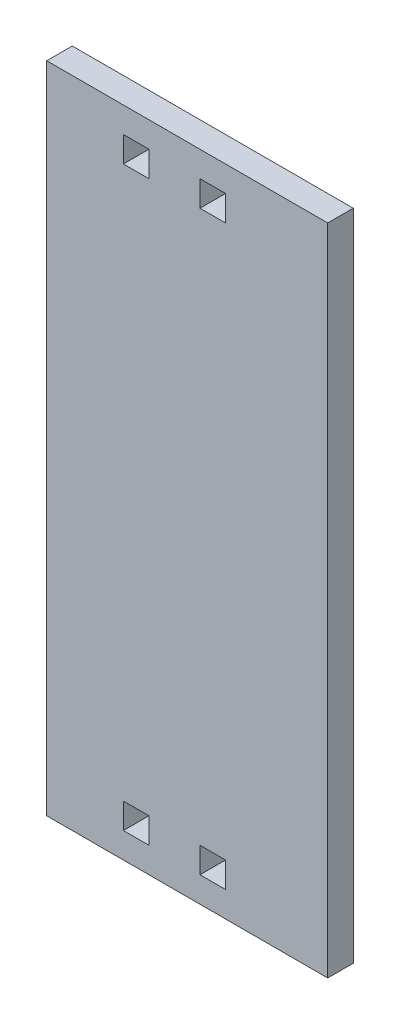
from build123d import *

# Parameters (mm, degrees)
ESQUISSE1_W        = 5
ESQUISSE1_H        = 5
BOSS_EXTRU_1_DEPTH = 5


with BuildPart() as part:
    # Esquisse1 → Boss.-Extru.1 (new body)
    with BuildSketch(Plane.XY):
        Polygon((25, 120.5), (-25, 120.5), (-25, 56.5), (-25, -7.5), (25, -7.5), (30, -7.5), (30, 120.5), align=None)
        with Locations((-7.5, 0)):
            Rectangle(ESQUISSE1_W, ESQUISSE1_H, mode=Mode.SUBTRACT)
        with Locations((7.5, 0)):
            Rectangle(ESQUISSE1_W, ESQUISSE1_H, mode=Mode.SUBTRACT)
        with Locations((-7.5, 113)):
            Rectangle(ESQUISSE1_W, ESQUISSE1_H, mode=Mode.SUBTRACT)
        with Locations((7.5, 113)):
            Rectangle(ESQUISSE1_W, ESQUISSE1_H, mode=Mode.SUBTRACT)
    extrude(amount=BOSS_EXTRU_1_DEPTH)


solid = part.part
